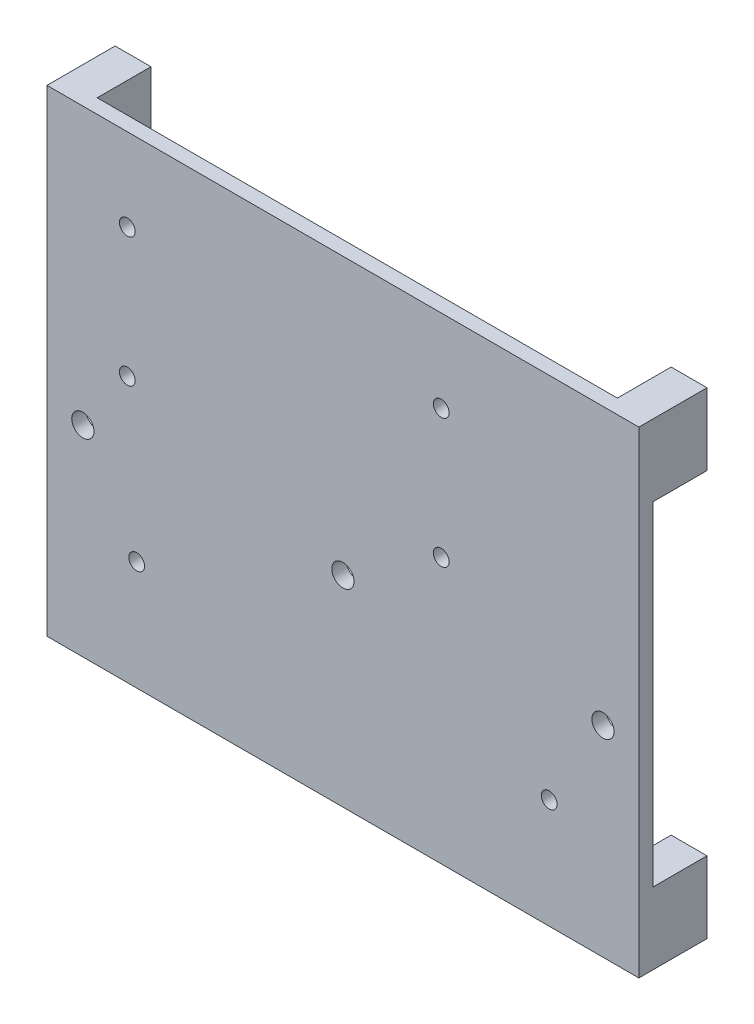
from build123d import *

# Parameters (mm, degrees)
SKETCH1_W           = 165
SKETCH1_H           = 133
BOSS_EXTRUDE1_DEPTH = 4
SKETCH2_R           = 2.2
CUT_EXTRUDE1_DEPTH  = 4
SKETCH3_W           = 10
SKETCH3_H           = 20
BOSS_EXTRUDE2_DEPTH = 15
CUT_EXTRUDE2_REACH  = 134.429
SKETCH4_R           = 3.1


with BuildPart() as part:
    # Sketch1 → Boss-Extrude1 (new body)
    with BuildSketch(Plane.XY):
        with Locations((0, 36)):
            Rectangle(SKETCH1_W, SKETCH1_H)
    extrude(amount=BOSS_EXTRUDE1_DEPTH)

    # Sketch2 → Cut-Extrude1 (cut)
    with BuildSketch(Plane(origin=(0, 0, 0), x_dir=(-1, 0, 0), z_dir=(0, 0, -1))):
        with Locations((-27.4, 43.5)):
            Circle(SKETCH2_R)
        with Locations((60.1, 43.5)):
            Circle(SKETCH2_R)
        with Locations((60.1, 79.5)):
            Circle(SKETCH2_R)
        with Locations((-27.4, 79.5)):
            Circle(SKETCH2_R)
        with Locations((57.5, 0)):
            Circle(SKETCH2_R)
        with Locations((-57.5, 0)):
            Circle(SKETCH2_R)
    extrude(amount=-CUT_EXTRUDE1_DEPTH, mode=Mode.SUBTRACT)

    # Sketch3 → Boss-Extrude2 (add)
    with BuildSketch(Plane(origin=(0, 0, 0), x_dir=(-1, 0, 0), z_dir=(0, 0, -1))):
        with Locations((-77.5, -20.5)):
            Rectangle(SKETCH3_W, SKETCH3_H)
        with Locations((-77.5, 92.5)):
            Rectangle(SKETCH3_W, SKETCH3_H)
        with Locations((77.5, -20.5)):
            Rectangle(SKETCH3_W, SKETCH3_H)
        with Locations((77.5, 92.5)):
            Rectangle(SKETCH3_W, SKETCH3_H)
    extrude(amount=BOSS_EXTRUDE2_DEPTH)

    # Sketch4 → Cut-Extrude2 (cut, up to next)
    with BuildSketch(Plane(origin=(0, 0, 0), x_dir=(-1, 0, 0), z_dir=(0, 0, -1)), mode=Mode.PRIVATE) as cut_extrude2_sk1:
        with Locations((-72.5, 25.5)):
            Circle(SKETCH4_R)
    cut_extrude2_tool1 = extrude(cut_extrude2_sk1.sketch, amount=-CUT_EXTRUDE2_REACH, mode=Mode.PRIVATE) & part.part
    # Sketch4 → Cut-Extrude2 (cut, up to next)
    with BuildSketch(Plane(origin=(0, 0, 0), x_dir=(-1, 0, 0), z_dir=(0, 0, -1)), mode=Mode.PRIVATE) as cut_extrude2_sk2:
        with Locations((72.5, 25.5)):
            Circle(SKETCH4_R)
    cut_extrude2_tool2 = extrude(cut_extrude2_sk2.sketch, amount=-CUT_EXTRUDE2_REACH, mode=Mode.PRIVATE) & part.part
    # Sketch4 → Cut-Extrude2 (cut, up to next)
    with BuildSketch(Plane(origin=(0, 0, 0), x_dir=(-1, 0, 0), z_dir=(0, 0, -1)), mode=Mode.PRIVATE) as cut_extrude2_sk3:
        with Locations((0, 25.5)):
            Circle(SKETCH4_R)
    cut_extrude2_tool3 = extrude(cut_extrude2_sk3.sketch, amount=-CUT_EXTRUDE2_REACH, mode=Mode.PRIVATE) & part.part
    add(cut_extrude2_tool1.solids().sort_by_distance((72.5, 25.5, 0))[0], mode=Mode.SUBTRACT)
    add(cut_extrude2_tool2.solids().sort_by_distance((-72.5, 25.5, 0))[0], mode=Mode.SUBTRACT)
    add(cut_extrude2_tool3.solids().sort_by_distance((0, 25.5, 0))[0], mode=Mode.SUBTRACT)


solid = part.part
